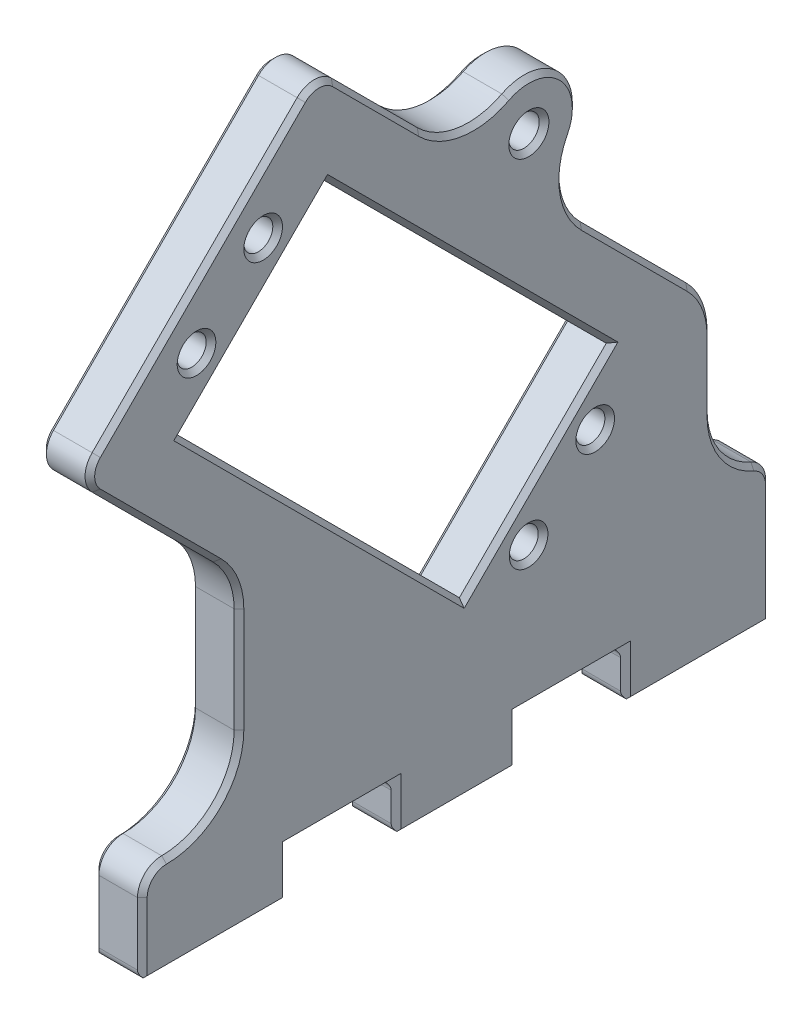
from build123d import *

# Parameters (mm, degrees)
SKETCH_1_R      = 1.575
SKETCH_1_R_2    = 1.5
EXTRUDE_1_DEPTH = 5
CHAMFER_1_SIZE  = 0.5
FILLET_1_R      = 1


with BuildPart() as part:
    # 草图1 → 凸台-拉伸1 (new body)
    with BuildSketch(Plane(origin=(5, 0, 0), x_dir=(0, 0, -1), z_dir=(1, 0, 0))):
        with BuildLine():
            Line((58.94037044, 21.690945588), (58.94037044, 28.938446994))
            ThreePointArc((58.94037044, 28.938446994), (58.369466934, 31.808572737), (56.743671299, 34.241747853))
            Line((56.743671299, 34.241747853), (45.79785286, 45.187566291))
            ThreePointArc((45.79785286, 45.187566291), (43.689786601, 49.341242238), (44.440461488, 53.938355946))
            ThreePointArc((44.440461488, 53.938355946), (43.535533906, 59.772215716), (37.701674136, 60.677143298))
            ThreePointArc((37.701674136, 60.677143298), (33.104560428, 59.926468411), (28.950884481, 62.03453467))
            Line((28.950884481, 62.03453467), (20.049497475, 70.935921677))
            ThreePointArc((20.049497475, 70.935921677), (18.281730522, 71.668154724), (16.513963569, 70.935921677))
            Line((16.513963569, 70.935921677), (-4.699239867, 49.722718241))
            ThreePointArc((-4.699239867, 49.722718241), (-5.431472914, 47.954951288), (-4.699239867, 46.187184335))
            Line((-4.699239867, 46.187184335), (7.803300859, 33.68464361))
            ThreePointArc((7.803300859, 33.68464361), (9.429096494, 31.251468493), (10, 28.381342751))
            Line((10, 28.381342751), (10, 17.5))
            ThreePointArc((10, 17.5), (7.803300859, 12.196699141), (2.5, 10))
            ThreePointArc((2.5, 10), (0.732233047, 9.267766953), (0, 7.5))
            Line((0, 7.5), (0, 0))
            Line((0, 0), (15, 0))
            Line((15, 0), (15, 5))
            Line((15, 5), (26.25, 5))
            Line((26.25, 5), (26.25, 0))
            Line((26.25, 0), (38.75, 0))
            Line((38.75, 0), (38.75, 5))
            Line((38.75, 5), (50, 5))
            Line((50, 5), (50, 0))
            Line((50, 0), (65, 0))
            Line((65, 0), (65, 12.5))
            ThreePointArc((65, 12.5), (64.587190878, 13.876093833), (63.48509261, 14.797736397))
            ThreePointArc((63.48509261, 14.797736397), (60.178797805, 17.562664088), (58.94037044, 21.690945588))
        make_face()
        with Locations(Location((40, 56.23668181, 0), (0, 0, 180))):
            Circle(SKETCH_1_R, mode=Mode.SUBTRACT)
        with Locations(Location((39.972231035, 19.370159659, 0), (0, 0, 180))):
            Circle(SKETCH_1_R_2, mode=Mode.SUBTRACT)
        with Locations(Location((12.501132586, 60.629840341, 0), (0, 0, 180))):
            Circle(SKETCH_1_R_2, mode=Mode.SUBTRACT)
        with Locations(Location((5.606841469, 53.735549225, 0), (0, 0, 180))):
            Circle(SKETCH_1_R_2, mode=Mode.SUBTRACT)
        with Locations(Location((46.866522151, 26.264450775, 0), (0, 0, 180))):
            Circle(SKETCH_1_R_2, mode=Mode.SUBTRACT)
        Polygon((19.165613998, 62.273863607), (48.510545417, 32.928932188), (33.307749622, 17.726136393), (3.962818203, 47.071067812), align=None, mode=Mode.SUBTRACT)
    extrude(amount=-EXTRUDE_1_DEPTH)

    # 倒角1
    chamfer_1_edges = [part.edges().sort_by_distance(p)[0] for p in [
        (0, 5, -44.375),
        (0, 2.5, -50),
        (0, 0, -57.5),
        (0, 6.25, -65),
        (0, 25.314696291, -58.94037044),
        (0, 31.808572737, -58.369466934),
        (0, 39.714657072, -51.27076208),
        (0, 49.341242238, -43.689786601),
        (5, 6.25, -65),
        (5, 0, -57.5),
        (5, 2.5, -50),
        (5, 5, -44.375),
        (5, 2.5, -38.75),
        (5, 0, -32.5),
        (0, 59.772215716, -43.535533906),
        (5, 2.5, -26.25),
        (5, 5, -20.625),
        (5, 2.5, -15),
        (5, 0, -7.5),
        (5, 3.75, 0),
        (5, 9.267766953, -0.732233047),
        (5, 12.196699141, -7.803300859),
        (5, 22.940671375, -10),
        (5, 31.251468493, -9.429096494),
        (5, 39.935913973, -1.552030496),
        (0, 59.926468411, -33.104560428),
        (5, 47.954951288, 5.431472914),
        (5, 60.329319959, -5.907361851),
        (5, 71.668154724, -18.281730522),
        (5, 66.485228174, -24.500190978),
        (5, 59.926468411, -33.104560428),
        (5, 59.772215716, -43.535533906),
        (5, 49.341242238, -43.689786601),
        (5, 39.714657072, -51.27076208),
        (5, 31.808572737, -58.369466934),
        (5, 25.314696291, -58.94037044),
        (0, 66.485228174, -24.500190978),
        (5, 17.562664088, -60.178797805),
        (5, 13.876093833, -64.587190878),
        (0, 71.668154724, -18.281730522),
        (0, 60.329319959, -5.907361851),
        (0, 47.954951288, 5.431472914),
        (0, 13.876093833, -64.587190878),
        (0, 39.935913973, -1.552030496),
        (0, 31.251468493, -9.429096494),
        (0, 22.940671375, -10),
        (0, 12.196699141, -7.803300859),
        (0, 56.23668181, -41.575),
        (5, 56.23668181, -41.575),
        (0, 9.267766953, -0.732233047),
        (0, 19.370159659, -41.472231035),
        (5, 19.370159659, -41.472231035),
        (0, 3.75, 0),
        (0, 0, -7.5),
        (0, 54.67246571, -11.5642161),
        (0, 47.601397898, -33.838079708),
        (0, 25.32753429, -40.90914752),
        (0, 32.398602102, -18.635283912),
        (5, 54.67246571, -11.5642161),
        (5, 32.398602102, -18.635283912),
        (5, 25.32753429, -40.90914752),
        (5, 47.601397898, -33.838079708),
        (0, 2.5, -15),
        (0, 5, -20.625),
        (0, 60.629840341, -14.001132586),
        (5, 60.629840341, -14.001132586),
        (0, 2.5, -26.25),
        (0, 17.562664088, -60.178797805),
        (0, 53.735549225, -7.106841469),
        (5, 53.735549225, -7.106841469),
        (0, 0, -32.5),
        (0, 26.264450775, -48.366522151),
        (5, 26.264450775, -48.366522151),
        (0, 2.5, -38.75),
    ]]
    chamfer(chamfer_1_edges, length=CHAMFER_1_SIZE)

    # 圆角1
    fillet_1_edges = [part.edges().sort_by_distance(p)[0] for p in [
        (2.5, 0, 0),
        (2.5, 0, -15),
        (2.5, 5, -15),
        (2.5, 5, -26.25),
        (2.5, 0, -26.25),
        (2.5, 0, -38.75),
        (2.5, 5, -38.75),
        (2.5, 5, -50),
        (2.5, 0, -50),
        (2.5, 0, -65),
    ]]
    fillet(fillet_1_edges, radius=FILLET_1_R)


solid = part.part
